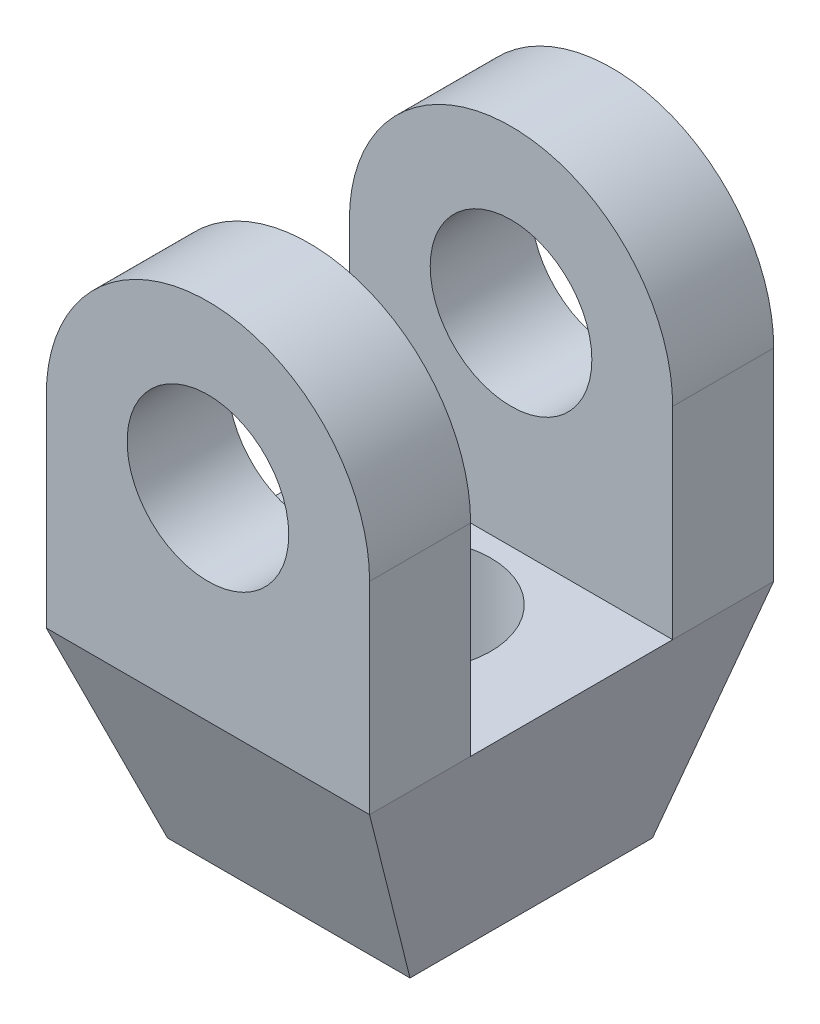
from build123d import *

# Parameters (mm, degrees)
BOSS_EXTRUDE1_DEPTH     = 4
CUT_EXTRUDE1_DEPTH      = 14.124404748
CUT_EXTRUDE1_DEPTH_BACK = 14.124404748
SKETCH2_R               = 2
CUT_EXTRUDE2_DEPTH      = 14.124404748
CUT_EXTRUDE2_DEPTH_BACK = 14.124404748
CUT_EXTRUDE3_DEPTH      = 10.861541462
CUT_EXTRUDE3_DEPTH_BACK = 10.861541462
CUT_EXTRUDE4_DEPTH      = 16.394804318
CUT_EXTRUDE4_DEPTH_BACK = 16.394804318
SKETCH8_R               = 2


with BuildPart() as part:
    # Sketch1 → Boss-Extrude1 (new, symmetric)
    with BuildSketch(Plane(origin=(0, 0, 0), x_dir=(0, 0, -1), z_dir=(1, 0, 0))):
        Polygon((2.5, 7.5), (5, 7.5), (5, -2.5), (3, -7.5), (-3, -7.5), (-5, -2.5), (-5, 7.5), (-2.5, 7.5), (-2.5, -2.5), (2.5, -2.5), align=None)
    extrude(amount=BOSS_EXTRUDE1_DEPTH, both=True)

    # Sketch2 → Cut-Extrude1 (cut, two sides: drawn at the far end of the back side and taken through both)
    with BuildSketch(Plane.XY.offset(5).offset(-CUT_EXTRUDE1_DEPTH_BACK)):
        with Locations((0, 2.5)):
            Circle(SKETCH2_R)
    extrude(amount=CUT_EXTRUDE1_DEPTH + CUT_EXTRUDE1_DEPTH_BACK, mode=Mode.SUBTRACT)

    # Sketch3 → Cut-Extrude2 (cut, two sides: drawn at the far end of the back side and taken through both)
    with BuildSketch(Plane.XY.offset(5).offset(-CUT_EXTRUDE2_DEPTH_BACK)):
        with BuildLine():
            Line((-4, 2.5), (-4, 7.5))
            Line((-4, 7.5), (4, 7.5))
            Line((4, 7.5), (4, 2.5))
            ThreePointArc((4, 2.5), (0, 6.5), (-4, 2.5))
        make_face()
    extrude(amount=CUT_EXTRUDE2_DEPTH + CUT_EXTRUDE2_DEPTH_BACK, mode=Mode.SUBTRACT)

    # Sketch5 → Cut-Extrude3 (cut, two sides: drawn at the far end of the back side and taken through both)
    with BuildSketch(Plane.XY.offset(-CUT_EXTRUDE3_DEPTH_BACK)):
        Polygon((-4, -2.5), (-4, -7.5), (-3, -7.5), align=None)
        Polygon((3, -7.5), (4, -2.5), (4, -7.5), align=None)
    extrude(amount=CUT_EXTRUDE3_DEPTH + CUT_EXTRUDE3_DEPTH_BACK, mode=Mode.SUBTRACT)

    # Sketch8 → Cut-Extrude4 (cut, two sides: drawn at the far end of the back side and taken through both)
    with BuildSketch(Plane.XZ.offset(7.5).offset(-CUT_EXTRUDE4_DEPTH_BACK)):
        with Locations(Location((0, 0, 0), (0, 0, 270))):
            Circle(SKETCH8_R)
    extrude(amount=CUT_EXTRUDE4_DEPTH + CUT_EXTRUDE4_DEPTH_BACK, mode=Mode.SUBTRACT)


solid = part.part
